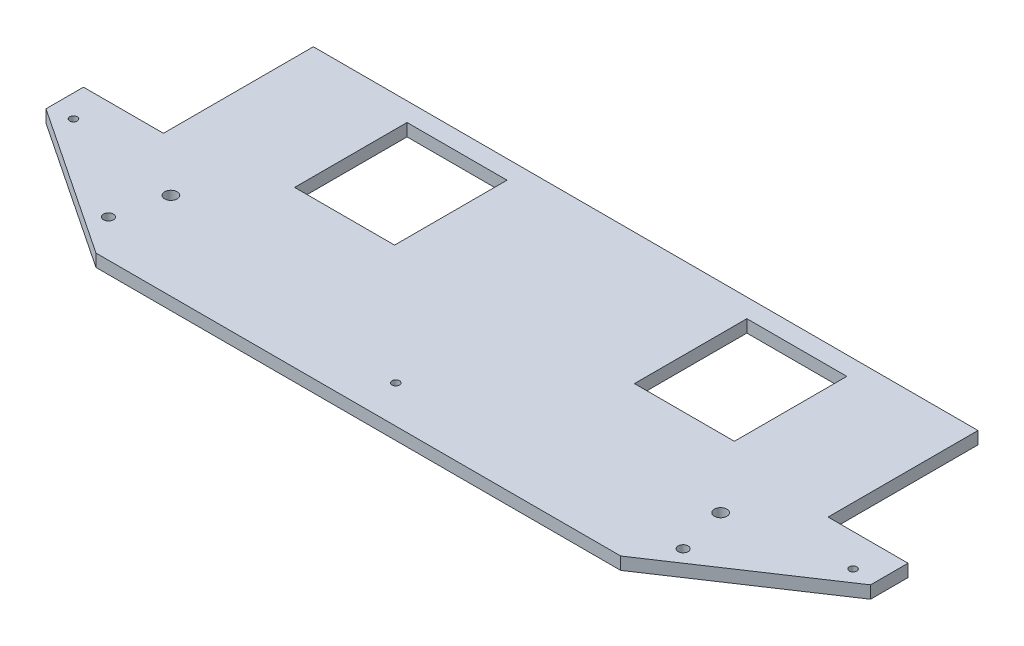
from build123d import *

# Parameters (mm, degrees)
ESQUISSE1_W             = 330
ESQUISSE1_H             = 250
EXTRUSION1_DEPTH        = 5
ESQUISSE2_W             = 32
ESQUISSE2_H             = 60
ENL_V_MAT_EXTRU_1_DEPTH = 362.087798138
ESQUISSE4_W             = 40
ESQUISSE4_H             = 45
ENL_V_MAT_EXTRU_2_DEPTH = 362.087798138
CHANFREIN1_SIZE         = 15
ESQUISSE5_W             = 330
ESQUISSE5_H             = 5
ENL_V_MAT_EXTRU_3_DEPTH = 15
ENL_V_MAT_EXTRU_5_DEPTH = 352.563639113
ESQUISSE9_R             = 17.5
ENL_V_MAT_EXTRU_6_DEPTH = 352.563639255
SKETCH1_R               = 2
EXTRUDE1_DEPTH          = 5
ESQUISSE10_R            = 2.5
ESQUISSE10_R_2          = 1.5
ENL_V_MAT_EXTRU_7_DEPTH = 6


with BuildPart() as part:
    # Esquisse1 → Extrusion1 (new body)
    with BuildSketch(Plane(origin=(0, 0, 0), x_dir=(1, 0, 0), z_dir=(0, 1, 0))):
        with Locations((110.175955056, 108.746853933)):
            Rectangle(ESQUISSE1_W, ESQUISSE1_H)
    extrude(amount=EXTRUSION1_DEPTH)

    # Esquisse2 → Enlèv. mat.-Extru.1 (cut, through all)
    with BuildSketch(Plane(origin=(0, 5, 0), x_dir=(-1, 0, 0), z_dir=(0, 1, 0))):
        with Locations((38.824044944, -188.746853933)):
            Rectangle(ESQUISSE2_W, ESQUISSE2_H)
        with Locations((-259.175955056, -188.746853933)):
            Rectangle(ESQUISSE2_W, ESQUISSE2_H)
    extrude(amount=-ENL_V_MAT_EXTRU_1_DEPTH, mode=Mode.SUBTRACT)

    # Esquisse4 → Enlèv. mat.-Extru.2 (cut, through all)
    with BuildSketch(Plane(origin=(0, 5, 0), x_dir=(-1, 0, 0), z_dir=(0, 1, 0))):
        with Locations((-178.175955056, -188.746853933)):
            Rectangle(ESQUISSE4_W, ESQUISSE4_H)
        with Locations((-42.175955056, -188.746853933)):
            Rectangle(ESQUISSE4_W, ESQUISSE4_H)
    extrude(amount=-ENL_V_MAT_EXTRU_2_DEPTH, mode=Mode.SUBTRACT)

    # Chanfrein1
    chanfrein1_edges = [part.edges().sort_by_distance(p)[0] for p in [
        (275.175955056, 2.5, 16.253146067),
        (-54.824044944, 2.5, 16.253146067),
    ]]
    chamfer(chanfrein1_edges, length=CHANFREIN1_SIZE)

    # Esquisse5 → Enlèv. mat.-Extru.3 (cut)
    with BuildSketch(Plane(origin=(0, 0, -233.746853933), x_dir=(-1, 0, 0), z_dir=(0, 0, -1))):
        with Locations((-110.175955056, 2.5)):
            Rectangle(ESQUISSE5_W, ESQUISSE5_H)
    extrude(amount=-ENL_V_MAT_EXTRU_3_DEPTH, mode=Mode.SUBTRACT)

    # Esquisse8 → Enlèv. mat.-Extru.5 (cut, through all)
    with BuildSketch(Plane(origin=(0, 5, 0), x_dir=(-1, 0, 0), z_dir=(0, 1, 0))):
        with BuildLine():
            Line((-129.175955056, -33.746853933), (-195.175955056, 16.253146067))
            Line((-195.175955056, 16.253146067), (-25.175955056, 16.253146067))
            Line((-25.175955056, 16.253146067), (-61.175955056, -33.746853933))
            add(Edge.make_bspline(
                [(-95.175955056, -83.746853933), (-72.555573237, -83.746853933), (-61.175955056, -53.90180921), (-61.175955056, -33.746853933)],
                knots=[0, 0, 0, 0, 1, 1, 1, 1], degree=3))
            add(Edge.make_bspline(
                [(-95.175955056, -83.746853933), (-117.796336875, -83.746853933), (-129.175955056, -53.90180921), (-129.175955056, -33.746853933)],
                knots=[0, 0, 0, 0, 1, 1, 1, 1], degree=3))
        make_face()
    extrude(amount=-ENL_V_MAT_EXTRU_5_DEPTH, mode=Mode.SUBTRACT)

    # Esquisse9 → Enlèv. mat.-Extru.6 (cut, through all)
    with BuildSketch(Plane(origin=(0, 5, 0), x_dir=(-1, 0, 0), z_dir=(0, 1, 0))):
        with Locations(Location((-205.175955056, -33.746853933, 0), (0, 0, 90))):
            Circle(ESQUISSE9_R)
        with Locations(Location((-15.175955056, -33.746853933, 0), (0, 0, 90))):
            Circle(ESQUISSE9_R)
    extrude(amount=-ENL_V_MAT_EXTRU_6_DEPTH, mode=Mode.SUBTRACT)

    # Sketch1 → Extrude1 (cut)
    with BuildSketch(Plane.XZ):
        with Locations(Location((-4.824044944, -118.746853933, 0), (0, 0, 270))):
            Circle(SKETCH1_R)
        with Locations(Location((225.175955056, -118.746853933, 0), (0, 0, 90))):
            Circle(SKETCH1_R)
        Polygon((-54.824044944, -143.746853933), (5.175955056, -103.746853933), (215.175955056, -103.746853933), (275.175955056, -143.746853933), (275.175955056, 16.253146067), (-54.824044944, 16.253146067), align=None)
    extrude(amount=-EXTRUDE1_DEPTH, mode=Mode.SUBTRACT)

    # Esquisse10 → Enlèv. mat.-Extru.7 (cut)
    with BuildSketch(Plane.XZ):
        with Locations(Location((0.175955056, -138.746853933, 0), (0, 0, 270))):
            Circle(ESQUISSE10_R)
        with Locations(Location((220.175955056, -138.746853933, 0), (0, 0, 90))):
            Circle(ESQUISSE10_R)
        with Locations(Location((-45.824044944, -145.746853933, 0), (0, 0, 270))):
            Circle(ESQUISSE10_R_2)
        with Locations(Location((266.175955056, -145.746853933, 0), (0, 0, 90))):
            Circle(ESQUISSE10_R_2)
        with Locations(Location((110.175955056, -118.746853933, 0), (0, 0, 270))):
            Circle(ESQUISSE10_R_2)
    extrude(amount=-ENL_V_MAT_EXTRU_7_DEPTH, mode=Mode.SUBTRACT)


solid = part.part
